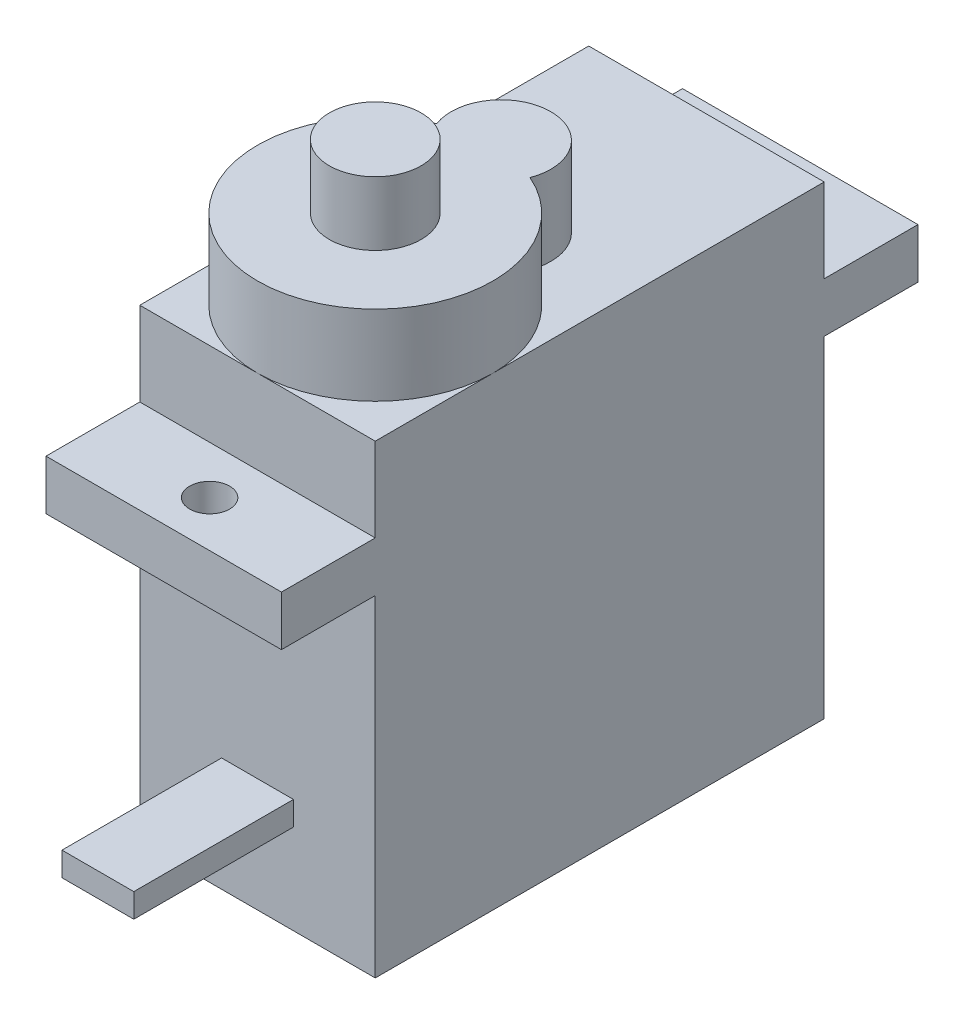
from build123d import *

# Parameters (mm, degrees)
SKETCH1_W           = 11.8
SKETCH1_H           = 22.5
BOSS_EXTRUDE1_DEPTH = 23.3
SKETCH2_W           = 11.8
SKETCH2_H           = 31.9
SKETCH2_R           = 1
BOSS_EXTRUDE2_DEPTH = 2.5
BOSS_EXTRUDE3_DEPTH = 4
SKETCH4_R           = 2.3
BOSS_EXTRUDE4_DEPTH = 3.2
SKETCH5_W           = 3.6
SKETCH5_H           = 1.2
BOSS_EXTRUDE5_DEPTH = 8


with BuildPart() as part:
    # Sketch1 → Boss-Extrude1 (new body)
    with BuildSketch(Plane(origin=(0, 0, 0), x_dir=(1, 0, 0), z_dir=(0, 1, 0))):
        Rectangle(SKETCH1_W, SKETCH1_H)
    extrude(amount=BOSS_EXTRUDE1_DEPTH)

    # Sketch2 → Boss-Extrude2 (add)
    with BuildSketch(Plane(origin=(0, 16.6, 0), x_dir=(1, 0, 0), z_dir=(0, 1, 0))):
        Rectangle(SKETCH2_W, SKETCH2_H)
        with Locations((0, 13.65)):
            Circle(SKETCH2_R, mode=Mode.SUBTRACT)
        with Locations((0, -13.65)):
            Circle(SKETCH2_R, mode=Mode.SUBTRACT)
    extrude(amount=BOSS_EXTRUDE2_DEPTH)

    # Sketch3 → Boss-Extrude3 (add)
    with BuildSketch(Plane(origin=(0, 23.3, 0), x_dir=(1, 0, 0), z_dir=(0, 1, 0))):
        with BuildLine():
            ThreePointArc((-2.338743727, 0.066666667), (0, -11.25), (2.338743727, 0.066666667))
            ThreePointArc((2.338743727, 0.066666667), (0, 3.45), (-2.338743727, 0.066666667))
        make_face()
    extrude(amount=BOSS_EXTRUDE3_DEPTH)

    # Sketch4 → Boss-Extrude4 (add)
    with BuildSketch(Plane(origin=(0, 27.3, 0), x_dir=(1, 0, 0), z_dir=(0, 1, 0))):
        with Locations((0, -5.35)):
            Circle(SKETCH4_R)
    extrude(amount=BOSS_EXTRUDE4_DEPTH)

    # Sketch5 → Boss-Extrude5 (add)
    with BuildSketch(Plane.XY.offset(11.25)):
        with Locations((0, 5.1)):
            Rectangle(SKETCH5_W, SKETCH5_H)
    extrude(amount=BOSS_EXTRUDE5_DEPTH)


solid = part.part
